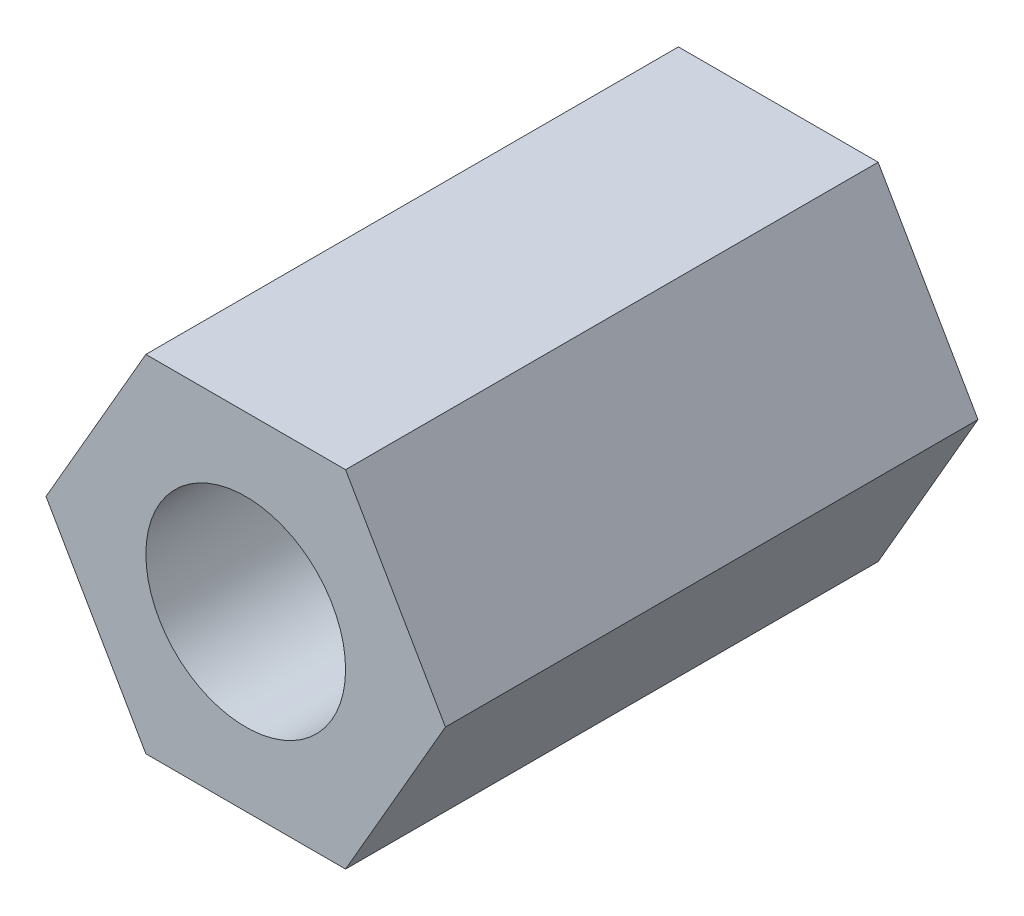
from build123d import *

# Parameters (mm, degrees)
SKETCH_1_R      = 1.5
EXTRUDE_1_DEPTH = 8


with BuildPart() as part:
    # 草图1 → 凸台-拉伸1 (new body)
    with BuildSketch(Plane.XY):
        Polygon((-1.5, 2.598076211), (-3, 0), (-1.5, -2.598076211), (1.5, -2.598076211), (3, 0), (1.5, 2.598076211), align=None)
        Circle(SKETCH_1_R, mode=Mode.SUBTRACT)
    extrude(amount=EXTRUDE_1_DEPTH)


solid = part.part
